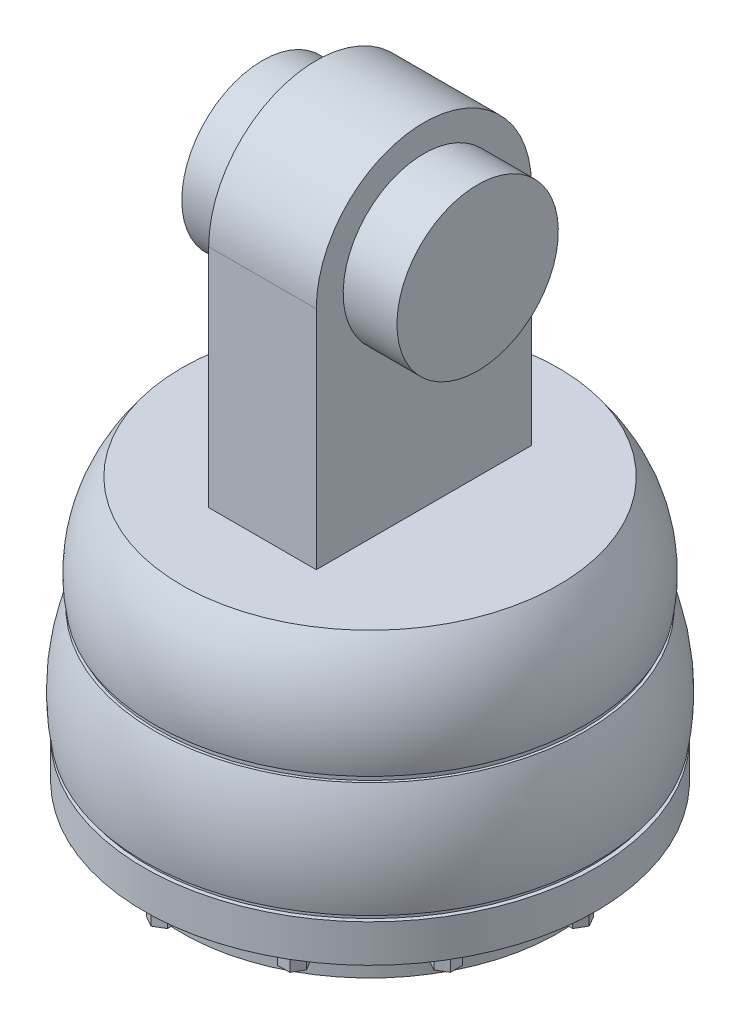
from build123d import *

# Parameters (mm, degrees)
SKETCH2_R           = 39.5
BOSS_EXTRUDE1_DEPTH = 1
SKETCH4_R           = 41.25
BOSS_EXTRUDE2_DEPTH = 1
SKETCH5_R           = 42
BOSS_EXTRUDE3_DEPTH = 7
SKETCH6_R           = 35
BOSS_EXTRUDE4_DEPTH = 7
BOSS_EXTRUDE5_DEPTH = 3
CIRPATTERN1_COUNT   = 12
SKETCH8_R           = 15
BOSS_EXTRUDE6_DEPTH = 10
SKETCH9_W           = 20
SKETCH9_H           = 40
BOSS_EXTRUDE7_DEPTH = 42
BOSS_EXTRUDE8_DEPTH = 20
SKETCH11_R          = 15
BOSS_EXTRUDE9_DEPTH = 10


with BuildPart() as part:
    # Sketch1 → Revolve1 (revolve)
    with BuildSketch(Plane.XY):
        with BuildLine():
            Line((-35, 0), (0, 0))
            Line((0, 0), (0, -20))
            Line((0, -20), (-40, -20))
            ThreePointArc((-40, -20), (-39.657515479, -9.46062113), (-35, 0))
        make_face()
    revolve(axis=Axis((0, 0, 0), (0, -1, 0)))

    # Sketch2 → Boss-Extrude1 (add)
    with BuildSketch(Plane.XZ.offset(20)):
        Circle(SKETCH2_R)
    extrude(amount=BOSS_EXTRUDE1_DEPTH)

    # Sketch3 → Revolve2 (revolve)
    with BuildSketch(Plane(origin=(0, 0, 0), x_dir=(0, 0, -1), z_dir=(1, 0, 0)), mode=Mode.PRIVATE) as revolve2_sk:
        with BuildLine():
            Line((0, -21), (-40, -21))
            ThreePointArc((-40, -21), (-42.384109041, -30.861589096), (-42, -41))
            Line((-42, -41), (0, -41))
            Line((0, -41), (0, -21))
        make_face()
    revolve(revolve2_sk.sketch.rotate(Axis((0, -21, 0), (0, -1, 0)), 90), axis=Axis((0, -21, 0), (0, -1, 0)))

    # Sketch4 → Boss-Extrude2 (add)
    with BuildSketch(Plane.XZ.offset(41)):
        with Locations(Location((0, 0, 0), (0, 0, 270))):
            Circle(SKETCH4_R)
    extrude(amount=BOSS_EXTRUDE2_DEPTH)

    # Sketch5 → Boss-Extrude3 (add)
    with BuildSketch(Plane.XZ.offset(42)):
        with Locations(Location((0, 0, 0), (0, 0, 270))):
            Circle(SKETCH5_R)
    extrude(amount=BOSS_EXTRUDE3_DEPTH)

    # Sketch6 → Boss-Extrude4 (add)
    with BuildSketch(Plane.XZ.offset(49)):
        with Locations(Location((0, 0, 0), (0, 0, 270))):
            Circle(SKETCH6_R)
    extrude(amount=BOSS_EXTRUDE4_DEPTH)

    # Sketch7 → Boss-Extrude5 (add)
    with BuildSketch(Plane.XZ.offset(49)):
        Polygon((40.75, 0), (39.625, 1.948557159), (37.375, 1.948557159), (36.25, 0), (37.375, -1.948557159), (39.625, -1.948557159), align=None)
        Polygon((39.047649731, 0.948557159), (37.952350269, 0.948557159), (37.404700538, 0), (37.952350269, -0.948557159), (39.047649731, -0.948557159), (39.595299462, 0), align=None, mode=Mode.SUBTRACT)
    boss_extrude5 = extrude(amount=BOSS_EXTRUDE5_DEPTH)

    # CirPattern1: Boss-Extrude5 ×12 about axis
    cirpattern1_axis = Axis((0, 0, 0), (0, 1, 0))
    for i in range(1, CIRPATTERN1_COUNT):
        add(boss_extrude5.rotate(cirpattern1_axis, i * 360 / CIRPATTERN1_COUNT))

    # Sketch8 → Boss-Extrude6 (add)
    with BuildSketch(Plane.XZ.offset(56)):
        with Locations(Location((0, 0, 0), (0, 0, 270))):
            Circle(SKETCH8_R)
    extrude(amount=BOSS_EXTRUDE6_DEPTH)

    # Sketch9 → Boss-Extrude7 (add)
    with BuildSketch(Plane(origin=(0, 0, 0), x_dir=(1, 0, 0), z_dir=(0, 1, 0))):
        Rectangle(SKETCH9_W, SKETCH9_H)
    extrude(amount=BOSS_EXTRUDE7_DEPTH)

    # Sketch10 → Boss-Extrude8 (add)
    with BuildSketch(Plane.ZY.offset(10)):
        with BuildLine():
            Line((-20, 42), (20, 42))
            ThreePointArc((20, 42), (0, 62), (-20, 42))
        make_face()
    extrude(amount=-BOSS_EXTRUDE8_DEPTH)

    # Sketch11 → Boss-Extrude9 (add)
    with BuildSketch(Plane.ZY.offset(10)):
        with Locations(Location((0, 42, 0), (0, 0, 90))):
            Circle(SKETCH11_R)
    boss_extrude9 = extrude(amount=BOSS_EXTRUDE9_DEPTH)

    # Mirror1: Boss-Extrude9 across plane
    add(boss_extrude9.mirror(Plane(origin=(0, 0, 0), x_dir=(0, 0, 1), z_dir=(1, 0, 0))))


solid = part.part
